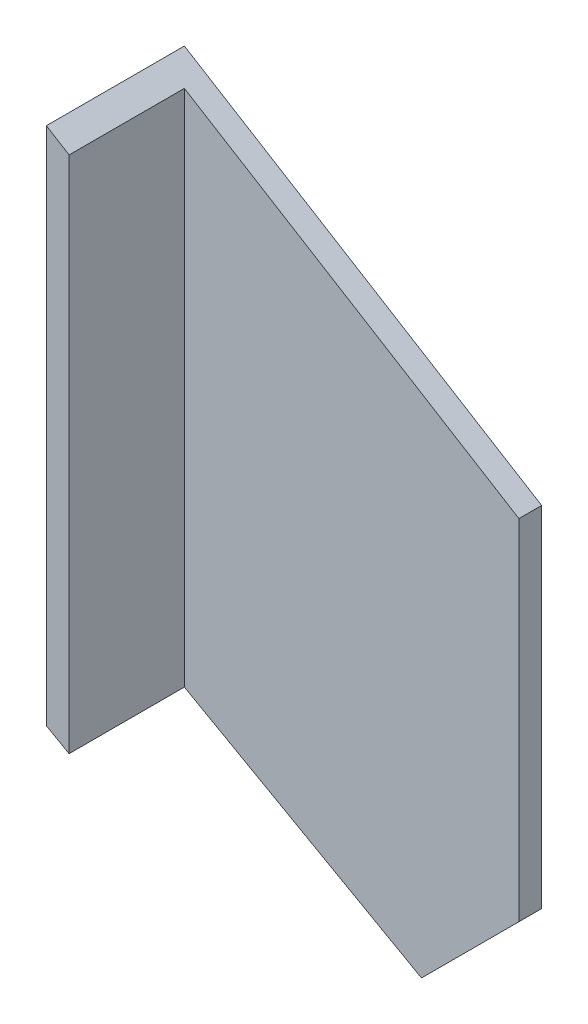
from build123d import *

# Parameters (mm, degrees)
EXTRUDE_1_DEPTH = 14
EXTRUDE_2_DEPTH = 71


with BuildPart() as part:
    # 草图1 → 凸台-拉伸1 (new body)
    with BuildSketch(Plane.XY):
        Polygon((71.4349048, -49.703584356), (71.4349048, -264.703584356), (11.4349048, -324.703584356), (-148.5650952, -234.703584356), (-148.5650952, 85.296415644), align=None)
    extrude(amount=EXTRUDE_1_DEPTH)

    # 草图2 → 凸台-拉伸2 (add)
    with BuildSketch(Plane.XY.offset(14)):
        Polygon((-134.5650952, 76.705506553), (-134.5650952, -242.578584356), (-148.5650952, -234.703584356), (-148.5650952, 85.296415644), align=None)
    extrude(amount=EXTRUDE_2_DEPTH)


solid = part.part
